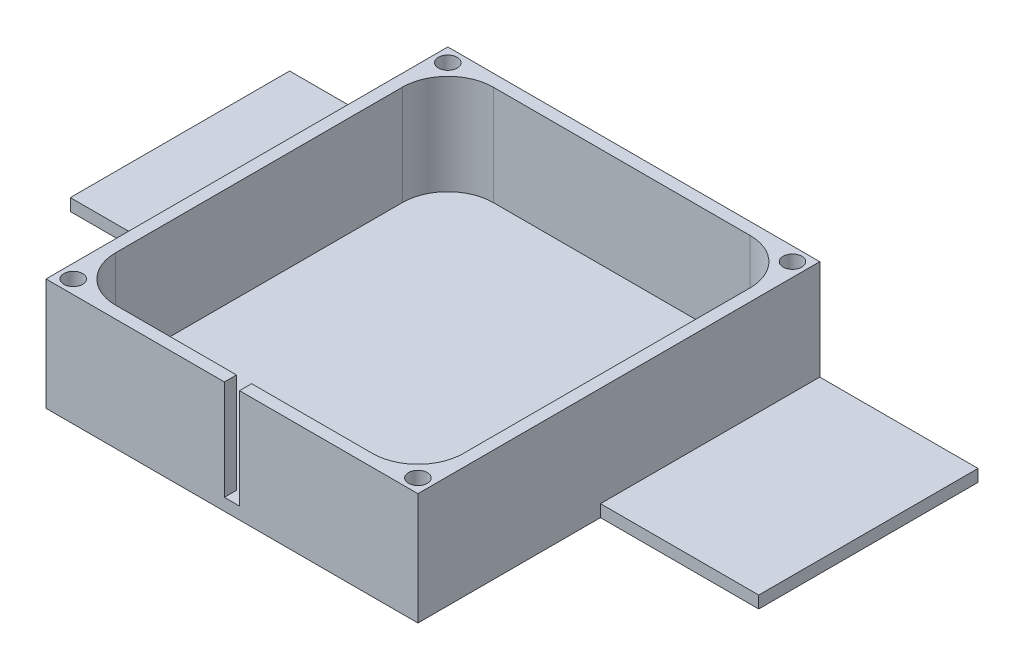
from build123d import *

# Parameters (mm, degrees)
SKETCH1_R           = 1.55
SKETCH1_W           = 61.4
SKETCH1_H           = 66.34
BOSS_EXTRUDE1_DEPTH = 2
BOSS_EXTRUDE2_DEPTH = 16.5
FILLET1_R           = 7.5
SKETCH3_R           = 1.55
CUT_EXTRUDE1_DEPTH  = 10


with BuildPart() as part:
    # Sketch1 → Boss-Extrude1 (new body)
    # profile 1 of 2: a face of its own
    with BuildSketch(Plane(origin=(0, 0, 0), x_dir=(1, 0, 0), z_dir=(0, 1, 0))):
        Polygon((42.27964617, -55.129137945), (42.27964617, -47.129137945), (64.04371989, -47.129137945), (64.04371989, -55.129137945), (110.09964617, -55.129137945), (110.09964617, -91.329137945), (-3.55035383, -91.329137945), (-3.55035383, -55.129137945), align=None)
        with Locations(Location((46.27964617, -51.129137945, 0), (0, 0, 270))):
            Circle(SKETCH1_R, mode=Mode.SUBTRACT)
        with Locations(Location((60.04371989, -51.129137945, 0), (0, 0, 270))):
            Circle(SKETCH1_R, mode=Mode.SUBTRACT)
    # profile 2 of 2: a face of its own
    with BuildSketch(Plane(origin=(0, 0, 0), x_dir=(1, 0, 0), z_dir=(0, 1, 0))):
        with Locations((53.27464617, -88.299137945)):
            Rectangle(SKETCH1_W, SKETCH1_H)
    extrude(amount=BOSS_EXTRUDE1_DEPTH)

    # Sketch2 → Boss-Extrude2 (add)
    with BuildSketch(Plane(origin=(0, 2, 0), x_dir=(1, 0, 0), z_dir=(0, 1, 0))):
        Polygon((22.57464617, -91.329137945), (22.57464617, -121.469137945), (52.02464617, -121.469137945), (52.02464617, -119.469137945), (24.57464617, -119.469137945), (24.57464617, -57.129137945), (81.97464617, -57.129137945), (81.97464617, -119.469137945), (54.52464617, -119.469137945), (54.52464617, -121.469137945), (83.97464617, -121.469137945), (83.97464617, -91.329137945), (83.97464617, -55.129137945), (64.04371989, -55.129137945), (42.27964617, -55.129137945), (22.57464617, -55.129137945), align=None)
    extrude(amount=BOSS_EXTRUDE2_DEPTH)

    # Fillet1
    fillet1_edges = [part.edges().sort_by_distance(p)[0] for p in [
        (81.97464617, 10.25, 119.469137945),
        (24.57464617, 10.25, 119.469137945),
        (24.57464617, 10.25, 57.129137945),
        (81.97464617, 10.25, 57.129137945),
    ]]
    fillet(fillet1_edges, radius=FILLET1_R)

    # Sketch3 → Cut-Extrude1 (cut)
    with BuildSketch(Plane(origin=(0, 18.5, 0), x_dir=(1, 0, 0), z_dir=(0, 1, 0))):
        with Locations(Location((24.82464617, -57.379137945, 0), (0, 0, 270))):
            Circle(SKETCH3_R)
        with Locations(Location((81.72464617, -57.379137945, 0), (0, 0, 90))):
            Circle(SKETCH3_R)
        with Locations(Location((81.72464617, -119.219137945, 0), (0, 0, 270))):
            Circle(SKETCH3_R)
        with Locations(Location((24.82464617, -119.219137945, 0), (0, 0, 90))):
            Circle(SKETCH3_R)
    extrude(amount=-CUT_EXTRUDE1_DEPTH, mode=Mode.SUBTRACT)


solid = part.part
